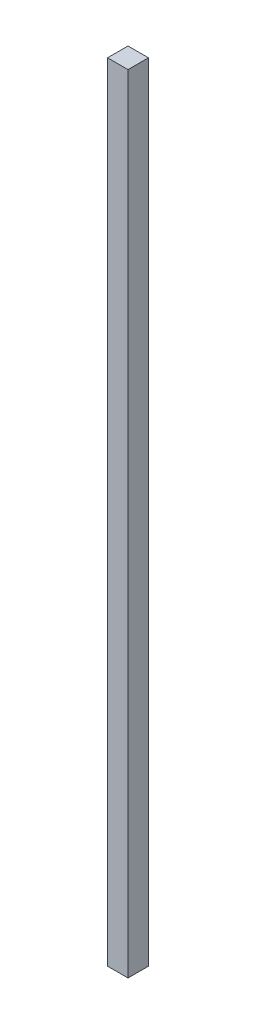
from build123d import *

# Parameters (mm, degrees)
SKETCH1_W           = 12.7
SKETCH1_H           = 12.7
BOSS_EXTRUDE1_DEPTH = 244.475


with BuildPart() as part:
    # Sketch1 → Boss-Extrude1 (new, symmetric)
    with BuildSketch(Plane(origin=(0, 0, 0), x_dir=(1, 0, 0), z_dir=(0, 1, 0))):
        Rectangle(SKETCH1_W, SKETCH1_H)
    extrude(amount=BOSS_EXTRUDE1_DEPTH, both=True)


solid = part.part
